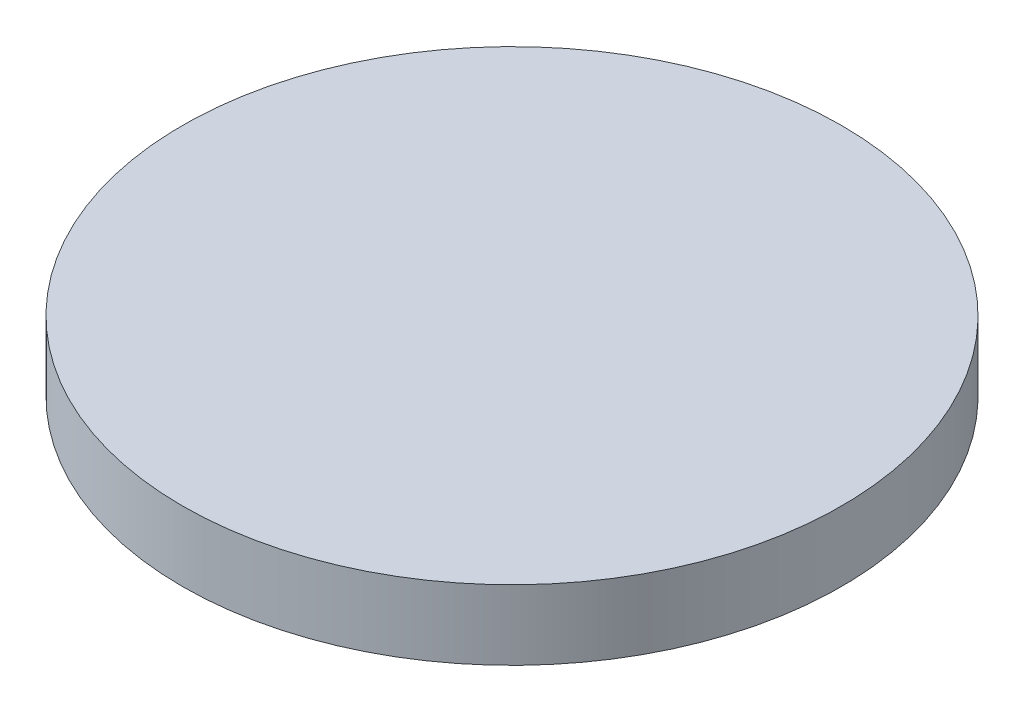
from build123d import *

# Parameters (mm, degrees)
SKETCH1_R      = 7.493
EXTRUDE1_DEPTH = 1.5875


with BuildPart() as part:
    # Sketch1 → Extrude1 (new body)
    with BuildSketch(Plane(origin=(0, 0, 0), x_dir=(1, 0, 0), z_dir=(0, 1, 0))):
        with Locations(Location((0, 0, 0), (0, 0, 270))):
            Circle(SKETCH1_R)
    extrude(amount=EXTRUDE1_DEPTH)


solid = part.part
